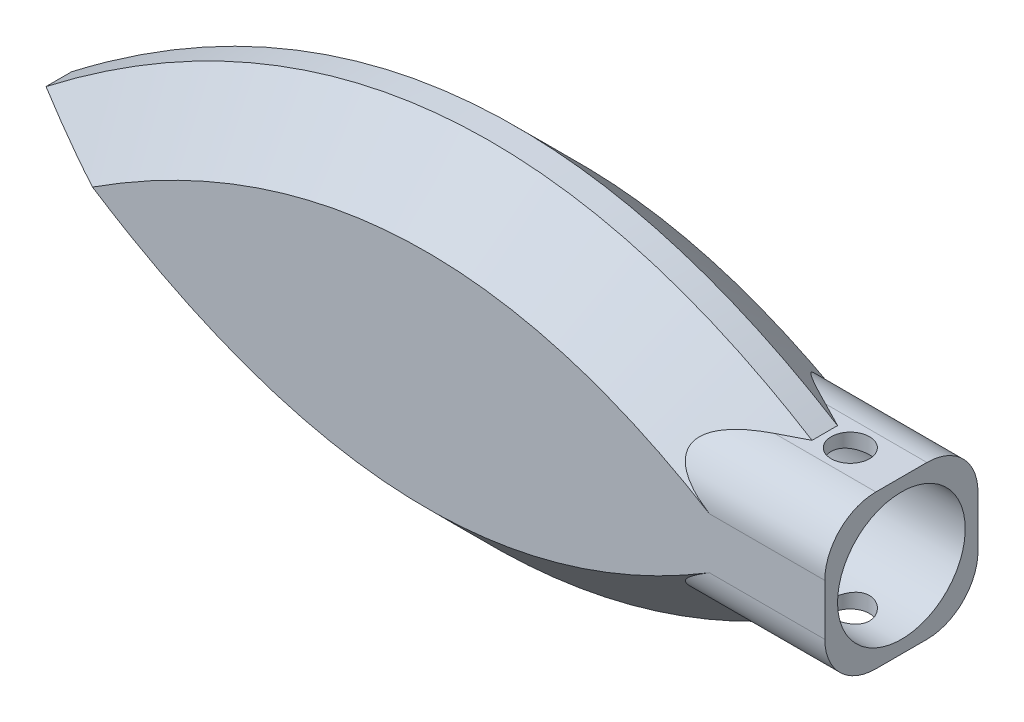
from build123d import *

# Parameters (mm, degrees)
BOSS_EXTRUDE2_DEPTH = 12
CHAMFER1_SIZE       = 5
SKETCH2_R           = 5
CUT_EXTRUDE1_DEPTH  = 12
SKETCH3_R           = 1.5
CUT_EXTRUDE2_DEPTH  = 21
FILLET1_R           = 4


with BuildPart() as part:
    # Sketch1 → Boss-Extrude2 (new body)
    with BuildSketch(Plane.XY):
        with BuildLine():
            Line((0, 6), (6, 6))
            Line((6, 6), (6, -6))
            Line((6, -6), (0, -6))
            add(Edge.make_bspline(
                [(0, -6), (-28.929278078, -23.954836636), (-60, 0)],
                knots=[0, 0, 0, 1, 1, 1], degree=2))
            add(Edge.make_bspline(
                [(0, 6), (-28.929278078, 23.954836636), (-60, 0)],
                knots=[0, 0, 0, 1, 1, 1], degree=2))
        make_face()
    extrude(amount=BOSS_EXTRUDE2_DEPTH)

    # Chamfer1
    chamfer1_edges = [part.edges().sort_by_distance(p)[0] for p in [
        (-30.877482461, -13.313053434, 0),
        (-30.877482461, 13.313053434, 0),
        (-30.877482461, -13.313053434, 12),
        (-30.877482461, 13.313053434, 12),
    ]]
    chamfer(chamfer1_edges, length=CHAMFER1_SIZE)

    # Sketch2 → Cut-Extrude1 (cut)
    with BuildSketch(Plane(origin=(6, 0, 0), x_dir=(0, 0, -1), z_dir=(1, 0, 0))):
        with Locations(Location((-6, 0, 0), (0, 0, 90))):
            Circle(SKETCH2_R)
    extrude(amount=-CUT_EXTRUDE1_DEPTH, mode=Mode.SUBTRACT)

    # Sketch3 → Cut-Extrude2 (cut)
    with BuildSketch(Plane(origin=(0, 6, 0), x_dir=(1, 0, 0), z_dir=(0, 1, 0))):
        with Locations(Location((2, -6, 0), (0, 0, 270))):
            Circle(SKETCH3_R)
    extrude(amount=-CUT_EXTRUDE2_DEPTH, mode=Mode.SUBTRACT)

    # Fillet1
    fillet1_edges = [part.edges().sort_by_distance(p)[0] for p in [
        (-2.54582803, -6, 0),
        (-2.54582803, 6, 0),
        (-2.54582803, -6, 12),
        (-2.54582803, 6, 12),
    ]]
    fillet(fillet1_edges, radius=FILLET1_R)


solid = part.part
